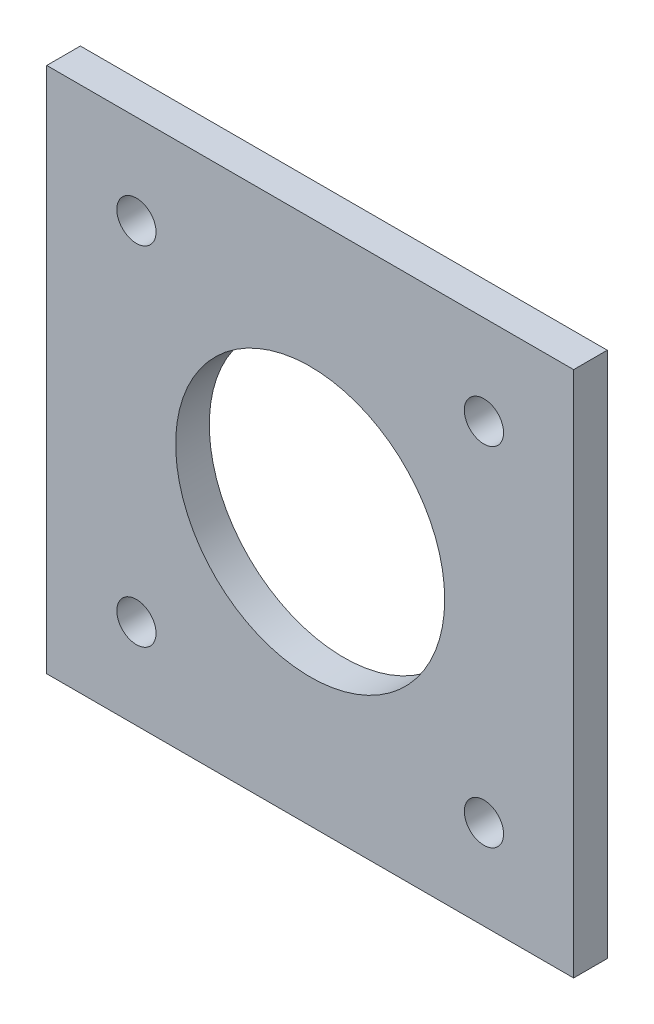
from build123d import *

# Parameters (mm, degrees)
SKETCH1_W           = 47
SKETCH1_H           = 47
SKETCH1_R           = 1.75
SKETCH1_R_2         = 12
BOSS_EXTRUDE1_DEPTH = 3


with BuildPart() as part:
    # Sketch1 → Boss-Extrude1 (new body)
    with BuildSketch(Plane.XY):
        Rectangle(SKETCH1_W, SKETCH1_H)
        with Locations((-15.5, 15.5)):
            Circle(SKETCH1_R, mode=Mode.SUBTRACT)
        with Locations((15.5, 15.5)):
            Circle(SKETCH1_R, mode=Mode.SUBTRACT)
        with Locations((15.5, -15.5)):
            Circle(SKETCH1_R, mode=Mode.SUBTRACT)
        with Locations((-15.5, -15.5)):
            Circle(SKETCH1_R, mode=Mode.SUBTRACT)
        Circle(SKETCH1_R_2, mode=Mode.SUBTRACT)
    extrude(amount=BOSS_EXTRUDE1_DEPTH)


solid = part.part
